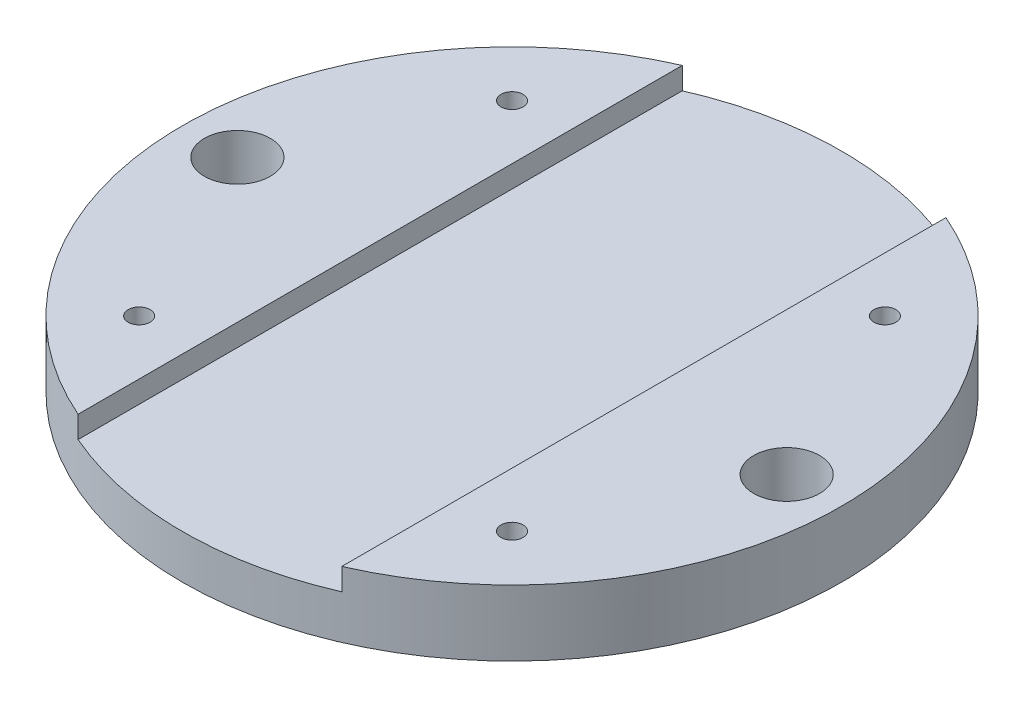
from build123d import *

# Parameters (mm, degrees)
SKETCH_1_R               = 15
EXTRUDE_1_DEPTH          = 3
CUT_EXTRUDE_2_DEPTH      = 22.424285286
CUT_EXTRUDE_2_DEPTH_BACK = 22.424285286
SKETCH_3_R               = 1.5
CUT_EXTRUDE_3_DEPTH      = 3
SKETCH_4_R               = 0.5
CUT_EXTRUDE_4_DEPTH      = 3


with BuildPart() as part:
    # 草图1 → 凸台-拉伸1 (new body)
    with BuildSketch(Plane(origin=(0, 0, 0), x_dir=(1, 0, 0), z_dir=(0, 1, 0))):
        with Locations(Location((0, 0, 0), (0, 0, 270))):
            Circle(SKETCH_1_R)
    extrude(amount=EXTRUDE_1_DEPTH)

    # 草图2 → 切除-拉伸2 (cut, two sides: drawn at the far end of the back side and taken through both)
    with BuildSketch(Plane.XY.offset(-CUT_EXTRUDE_2_DEPTH_BACK)):
        Polygon((-6, 55.426406871), (-6, 3), (-6, 2), (6, 2), (6, 3), (6, 55.426406871), (6, 160.279220614), (-6, 160.279220614), align=None)
    extrude(amount=CUT_EXTRUDE_2_DEPTH + CUT_EXTRUDE_2_DEPTH_BACK, mode=Mode.SUBTRACT)

    # 草图3 → 切除-拉伸3 (cut)
    with BuildSketch(Plane(origin=(0, 3, 0), x_dir=(1, 0, 0), z_dir=(0, 1, 0))):
        with Locations(Location((12.5, 0, 0), (0, 0, 270))):
            Circle(SKETCH_3_R)
        with Locations(Location((-12.5, 0, 0), (0, 0, 90))):
            Circle(SKETCH_3_R)
    extrude(amount=-CUT_EXTRUDE_3_DEPTH, mode=Mode.SUBTRACT)

    # 草图4 → 切除-拉伸4 (cut)
    with BuildSketch(Plane(origin=(0, 3, 0), x_dir=(1, 0, 0), z_dir=(0, 1, 0))):
        with Locations(Location((8.485281374, 8.485281374, 0), (0, 0, 270))):
            Circle(SKETCH_4_R)
        with Locations(Location((-8.485281374, 8.485281374, 0), (0, 0, 90))):
            Circle(SKETCH_4_R)
        with Locations(Location((8.485281374, -8.485281374, 0), (0, 0, 90))):
            Circle(SKETCH_4_R)
        with Locations(Location((-8.485281374, -8.485281374, 0), (0, 0, 270))):
            Circle(SKETCH_4_R)
    extrude(amount=-CUT_EXTRUDE_4_DEPTH, mode=Mode.SUBTRACT)


solid = part.part
